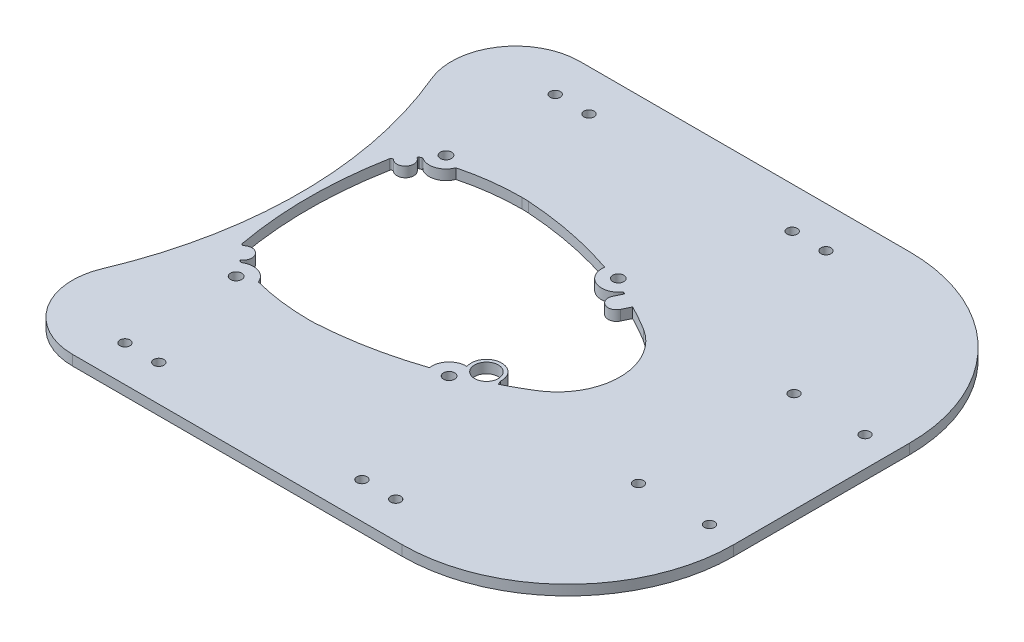
from build123d import *

# Parameters (mm, degrees)
SKETCH_1_W           = 205
SKETCH_1_H           = 150
EXTRUDE_1_DEPTH      = 3
FILLET_4_R           = 49
SKETCH_7_R           = 1.5
CUT_EXTRUDE_8_DEPTH  = 3
SKETCH_9_R           = 1.5
CUT_EXTRUDE_10_DEPTH = 10
CUT_EXTRUDE_11_DEPTH = 10
FILLET_6_R           = 19
CUT_EXTRUDE_12_DEPTH = 10
CUT_EXTRUDE_13_DEPTH = 10
SKETCH_14_R          = 1.5
CUT_EXTRUDE_14_DEPTH = 10


with BuildPart() as part:
    # 草图1 → 凸台-拉伸1 (new body)
    with BuildSketch(Plane(origin=(0, 0, 0), x_dir=(1, 0, 0), z_dir=(0, 1, 0))):
        Rectangle(SKETCH_1_W, SKETCH_1_H)
    extrude(amount=EXTRUDE_1_DEPTH)

    # 圆角4
    fillet_4_edges = [part.edges().sort_by_distance(p)[0] for p in [
        (102.5, 1.5, 75),
        (-102.5, 1.5, 75),
        (-102.5, 1.5, -75),
        (102.5, 1.5, -75),
    ]]
    fillet(fillet_4_edges, radius=FILLET_4_R)

    # 草图7 → 切除-拉伸8 (cut)
    with BuildSketch(Plane(origin=(0, 3, 0), x_dir=(1, 0, 0), z_dir=(0, 1, 0))):
        with Locations(Location((-29.157386068, -64.301525028, 0), (0, 0, 270))):
            Circle(SKETCH_7_R)
        with Locations(Location((-39.157386068, -64.301525028, 0), (0, 0, 270))):
            Circle(SKETCH_7_R)
        with Locations(Location((30.894708347, -64.301525028, 0), (0, 0, 270))):
            Circle(SKETCH_7_R)
        with Locations(Location((40.894708347, -64.301525028, 0), (0, 0, 270))):
            Circle(SKETCH_7_R)
    extrude(amount=-CUT_EXTRUDE_8_DEPTH, mode=Mode.SUBTRACT)

    # 草图9 → 切除-拉伸10 (cut)
    with BuildSketch(Plane(origin=(0, 3, 0), x_dir=(1, 0, 0), z_dir=(0, 1, 0))):
        with Locations(Location((-39.157386068, 62.897660639, 0), (0, 0, 270))):
            Circle(SKETCH_9_R)
        with Locations(Location((-29.157386068, 62.897660639, 0), (0, 0, 270))):
            Circle(SKETCH_9_R)
        with Locations(Location((30.894708347, 62.897660639, 0), (0, 0, 270))):
            Circle(SKETCH_9_R)
        with Locations(Location((40.894708347, 62.897660639, 0), (0, 0, 270))):
            Circle(SKETCH_9_R)
    extrude(amount=-CUT_EXTRUDE_10_DEPTH, mode=Mode.SUBTRACT)

    # 草图10 → 切除-拉伸11 (cut)
    with BuildSketch(Plane(origin=(0, 3, 0), x_dir=(1, 0, 0), z_dir=(0, 1, 0))):
        with BuildLine():
            Line((-73.543323974, 70.71314308), (-101.716637397, 64.641709711))
            Line((-101.716637397, 64.641709711), (-120.732928719, 20.042350207))
            Line((-120.732928719, 20.042350207), (-122.237815083, -19.221503099))
            Line((-122.237815083, -19.221503099), (-120.732928719, -55.065160124))
            Line((-120.732928719, -55.065160124), (-105.136833678, -72.986988636))
            Line((-105.136833678, -72.986988636), (-73.543323974, -70.71314308))
            ThreePointArc((-73.543323974, -70.71314308), (-51.63671506, 0), (-73.543323974, 70.71314308))
        make_face()
    extrude(amount=-CUT_EXTRUDE_11_DEPTH, mode=Mode.SUBTRACT)

    # 圆角6
    fillet_6_edges = [part.edges().sort_by_distance(p)[0] for p in [
        (-73.543323974, 1.5, 70.71314308),
        (-73.543323974, 1.5, -70.71314308),
    ]]
    fillet(fillet_6_edges, radius=FILLET_6_R)

    # 草图12 → 切除-拉伸12 (cut)
    with BuildSketch(Plane.XZ):
        with BuildLine():
            ThreePointArc((18.897832197, 24.895057939), (17.238405506, 26.535577082), (15.597886363, 24.876150392))
            ThreePointArc((15.597886363, 24.876150392), (17.257313053, 23.235631249), (18.897832197, 24.895057939))
        make_face()
        with BuildLine():
            ThreePointArc((-38.106495172, 30.853804553), (-39.765921863, 32.494323696), (-41.406441006, 30.834897006))
            ThreePointArc((-41.406441006, 30.834897006), (-39.747014316, 29.194377862), (-38.106495172, 30.853804553))
        make_face()
        with BuildLine():
            ThreePointArc((-38.061624777, -31.146179211), (-39.721051467, -29.505660067), (-41.361570611, -31.165086758))
            ThreePointArc((-41.361570611, -31.165086758), (-39.70214392, -32.805605901), (-38.061624777, -31.146179211))
        make_face()
        with BuildLine():
            ThreePointArc((18.934017999, -25.104928967), (17.274591309, -23.464409824), (15.634072166, -25.123836514))
            ThreePointArc((15.634072166, -25.123836514), (17.293498856, -26.764355657), (18.934017999, -25.104928967))
        make_face()
    extrude(amount=-CUT_EXTRUDE_12_DEPTH, mode=Mode.SUBTRACT)

    # 草图13 → 切除-拉伸13 (cut)
    with BuildSketch(Plane.XZ):
        with BuildLine():
            Line((26.61480093, 19.612214153), (26.666188604, 19.71827197))
            ThreePointArc((26.666188604, 19.71827197), (30.313326672, 17.774900087), (33.88381274, 15.694049394))
            ThreePointArc((33.88381274, 15.694049394), (40.367227696, 9.001039815), (42.765643177, -0.003328565))
            ThreePointArc((42.765643177, -0.003328565), (40.42568455, -9.115594182), (33.906678885, -15.898761304))
            ThreePointArc((33.906678885, -15.898761304), (30.337005033, -17.986010531), (26.690389558, -19.935722385))
            Line((26.690389558, -19.935722385), (25.532548484, -17.526968449))
            ThreePointArc((25.532548484, -17.526968449), (22.716941151, -16.174121744), (20.779380396, -18.624366055))
            ThreePointArc((20.779380396, -18.624366055), (20.843418949, -19.172440366), (21.026130239, -19.693115862))
            Line((21.026130239, -19.693115862), (22.185745114, -22.105559935))
            ThreePointArc((22.185745114, -22.105559935), (22.120138196, -22.135293343), (22.054511553, -22.16498319))
            ThreePointArc((22.054511553, -22.16498319), (21.751232804, -22.301507462), (21.447536985, -22.437101437))
            ThreePointArc((21.447536985, -22.437101437), (15.545446533, -20.479754915), (12.386930731, -25.836027409))
            Line((12.386930731, -25.836027409), (12.410357026, -25.980214552))
            ThreePointArc((12.410357026, -25.980214552), (-1.47362275, -29.712243457), (-15.72914447, -31.575851416))
            ThreePointArc((-15.72914447, -31.575851416), (-16.719690358, -31.623383328), (-17.711241588, -31.6397111))
            ThreePointArc((-17.711241588, -31.6397111), (-26.462410042, -31.087918414), (-35.07256713, -29.428816426))
            ThreePointArc((-35.07256713, -29.428816426), (-38.128149593, -26.465729775), (-42.354489521, -26.970227055))
            ThreePointArc((-42.354489521, -26.970227055), (-42.485618374, -27.015156622), (-42.622948132, -26.99634228))
            ThreePointArc((-42.622948132, -26.99634228), (-42.936287257, -26.874188517), (-43.249026231, -26.750506331))
            ThreePointArc((-43.249026231, -26.750506331), (-43.436203931, -26.504724926), (-43.30715674, -26.224027914))
            ThreePointArc((-43.30715674, -26.224027914), (-42.50269741, -25.320442029), (-42.216703432, -24.144929498))
            ThreePointArc((-42.216703432, -24.144929498), (-43.692757713, -21.878547542), (-46.367226636, -22.281585244))
            ThreePointArc((-46.367226636, -22.281585244), (-46.860214848, -22.378779459), (-47.188709306, -21.998548629))
            ThreePointArc((-47.188709306, -21.998548629), (-48.689594154, -11.423222518), (-49.23211637, -0.755708876))
            ThreePointArc((-49.23211637, -0.755708876), (-48.760359749, 10.508276151), (-47.220317614, 21.676453407))
            Line((-47.220317614, 21.676453407), (-47.119698515, 21.657663567))
            add(Edge.make_bspline(
                [(-46.475479293, 21.873699571), (-46.481416443, 21.878990088), (-46.49366456, 21.889259799), (-46.513346463, 21.90378483), (-46.533905404, 21.917051096), (-46.555345496, 21.929064993), (-46.577894182, 21.939890789), (-46.601673989, 21.949480941), (-46.627169568, 21.957832578), (-46.653795575, 21.964519322), (-46.680545337, 21.969310299), (-46.709311975, 21.972371309), (-46.738429322, 21.973256155), (-46.767145977, 21.972010713), (-46.795724419, 21.968666956), (-46.82428953, 21.963171942), (-46.852999039, 21.955374802), (-46.881198254, 21.94533369), (-46.908119901, 21.933370462), (-46.933798012, 21.919584429), (-46.95843616, 21.903901564), (-46.981993553, 21.88627978), (-47.003809411, 21.867282103), (-47.024483458, 21.84637613), (-47.043085347, 21.824509308), (-47.059709086, 21.801829379), (-47.074234734, 21.778732476), (-47.086701001, 21.755545057), (-47.097487374, 21.731826769), (-47.106640159, 21.707557971), (-47.114195339, 21.682607792), (-47.118046751, 21.665997077), (-47.119698515, 21.657663567)],
                knots=[0, 0, 0, 0, 0.033333333, 0.066666667, 0.1, 0.133333333, 0.166666667, 0.2, 0.233333333, 0.266666667, 0.3, 0.333333333, 0.366666667, 0.4, 0.433333333, 0.466666667, 0.5, 0.533333333, 0.566666667, 0.6, 0.633333333, 0.666666667, 0.7, 0.733333333, 0.766666667, 0.8, 0.833333333, 0.866666667, 0.9, 0.933333333, 0.966666667, 1, 1, 1, 1], degree=3, weights=[1, 1, 1, 1, 1, 1, 1, 1, 1, 1, 1, 1, 1, 1, 1, 1, 1, 1, 1, 1, 1, 1, 1, 1, 1, 1, 1, 1, 1, 1, 1, 1, 1]))
            add(Edge.make_bspline(
                [(-46.475479293, 21.873699571), (-46.441542372, 21.844326314), (-46.373480282, 21.785416866), (-46.267146759, 21.704615942), (-46.157618841, 21.629156164), (-46.044659168, 21.559555959), (-45.928427679, 21.495650161), (-45.775235011, 21.420879944), (-45.583271014, 21.343624051), (-45.351865298, 21.272878421), (-45.197991484, 21.244126299), (-45.119812284, 21.229518109)],
                knots=[0, 0, 0, 0, 0.081531876, 0.163516011, 0.246230457, 0.329945993, 0.414923827, 0.501413729, 0.663063513, 0.828811514, 1, 1, 1, 1], degree=3))
            add(Edge.make_bspline(
                [(-45.119812284, 21.229518109), (-45.10347042, 21.226878275), (-45.070237023, 21.221857155), (-45.018636987, 21.215181726), (-44.966204279, 21.209546482), (-44.912882213, 21.204982385), (-44.858655103, 21.201532533), (-44.803173129, 21.199244556), (-44.747712858, 21.198206407), (-44.692141031, 21.198407623), (-44.636830813, 21.199845948), (-44.582234115, 21.202474886), (-44.528246173, 21.206255192), (-44.474535086, 21.211187228), (-44.421187111, 21.217253569), (-44.386164986, 21.221999855), (-44.368795899, 21.224539993)],
                knots=[0, 0, 0, 0, 0.071428571, 0.142857143, 0.214285714, 0.285714286, 0.357142857, 0.428571429, 0.5, 0.571428571, 0.642857143, 0.714285714, 0.785714286, 0.857142857, 0.928571429, 1, 1, 1, 1], degree=3, weights=[1, 1, 1, 1, 1, 1, 1, 1, 1, 1, 1, 1, 1, 1, 1, 1, 1]))
            ThreePointArc((-44.368795899, 21.224539993), (-42.174575681, 23.248417126), (-43.264824353, 26.027272798))
            ThreePointArc((-43.264824353, 26.027272798), (-43.331100054, 26.173038393), (-43.234029958, 26.300386238))
            ThreePointArc((-43.234029958, 26.300386238), (-42.922123871, 26.424261407), (-42.60961668, 26.546612216))
            ThreePointArc((-42.60961668, 26.546612216), (-42.53822977, 26.556497597), (-42.470018891, 26.533236309))
            ThreePointArc((-42.470018891, 26.533236309), (-38.155738731, 26.008367792), (-35.006640277, 29.003643936))
            ThreePointArc((-35.006640277, 29.003643936), (-26.451945928, 30.657708049), (-17.756731467, 31.21624987))
            ThreePointArc((-17.756731467, 31.21624987), (-16.769691264, 31.201425409), (-15.783606847, 31.155538062))
            ThreePointArc((-15.783606847, 31.155538062), (-1.60416487, 29.326803391), (12.211087009, 25.647175584))
            ThreePointArc((12.211087009, 25.647175584), (13.450124475, 21.490567158), (17.442451568, 19.795299679))
            ThreePointArc((17.442451568, 19.795299679), (17.456596993, 16.711332393), (19.453005644, 14.360714005))
            ThreePointArc((19.453005644, 14.360714005), (19.464452028, 14.354228673), (19.475917322, 14.347776833))
            ThreePointArc((19.475917322, 14.347776833), (23.962460234, 14.396259956), (26.176962738, 18.298489649))
            ThreePointArc((26.176962738, 18.298489649), (26.172138613, 18.482606376), (26.159784418, 18.666371484))
            Line((26.159784418, 18.666371484), (26.61480093, 19.612214153))
        make_face()
        with BuildLine():
            ThreePointArc((25.176979152, 18.29276009), (24.398147495, 20.473968883), (22.427746808, 21.69124933))
            ThreePointArc((22.427746808, 21.69124933), (20.34735946, 21.51029195), (18.740310808, 20.176818396))
            ThreePointArc((18.740310808, 20.176818396), (18.317977538, 19.255926954), (18.177094051, 18.252653172))
            ThreePointArc((18.177094051, 18.252653172), (21.697090061, 14.77276408), (25.176979152, 18.29276009))
        make_face()
    extrude(amount=-CUT_EXTRUDE_13_DEPTH, mode=Mode.SUBTRACT)

    # 草图14 → 切除-拉伸14 (cut)
    with BuildSketch(Plane(origin=(0, 3, 0), x_dir=(1, 0, 0), z_dir=(0, 1, 0))):
        with Locations(Location((93.75, -24.403618381, 0), (0, 0, 270))):
            Circle(SKETCH_14_R)
        with Locations(Location((93.75, 21.596381619, 0), (0, 0, 270))):
            Circle(SKETCH_14_R)
        with Locations(Location((72.75, 21.596381619, 0), (0, 0, 270))):
            Circle(SKETCH_14_R)
        with Locations(Location((72.75, -24.403618381, 0), (0, 0, 270))):
            Circle(SKETCH_14_R)
    extrude(amount=-CUT_EXTRUDE_14_DEPTH, mode=Mode.SUBTRACT)


solid = part.part
